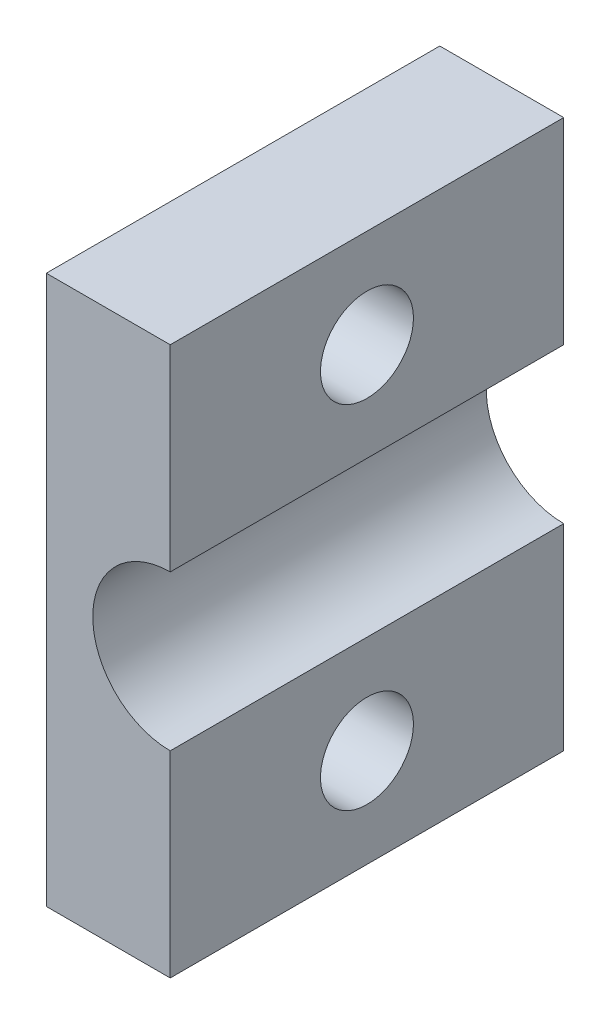
from build123d import *

# Parameters (mm, degrees)
SKETCH1_W           = 4
SKETCH1_H           = 12.7
BOSS_EXTRUDE1_DEPTH = 8.85
SKETCH2_R           = 2.5
CUT_EXTRUDE1_DEPTH  = 16.987886039
SKETCH3_R           = 1.5
CUT_EXTRUDE2_DEPTH  = 16.987886039


with BuildPart() as part:
    # Sketch1 → Boss-Extrude1 (new, symmetric)
    with BuildSketch(Plane(origin=(0, 0, 0), x_dir=(1, 0, 0), z_dir=(0, 1, 0))):
        with Locations((-2, 6.35)):
            Rectangle(SKETCH1_W, SKETCH1_H)
    extrude(amount=BOSS_EXTRUDE1_DEPTH, both=True)

    # Sketch2 → Cut-Extrude1 (cut, through all)
    with BuildSketch(Plane.XY):
        Circle(SKETCH2_R)
    extrude(amount=-CUT_EXTRUDE1_DEPTH, mode=Mode.SUBTRACT)

    # Sketch3 → Cut-Extrude2 (cut, through all)
    with BuildSketch(Plane(origin=(0, 0, 0), x_dir=(0, 0, -1), z_dir=(1, 0, 0))):
        with Locations((6.35, 5.675)):
            Circle(SKETCH3_R)
        with Locations((6.35, -5.675)):
            Circle(SKETCH3_R)
    extrude(amount=-CUT_EXTRUDE2_DEPTH, mode=Mode.SUBTRACT)


solid = part.part
